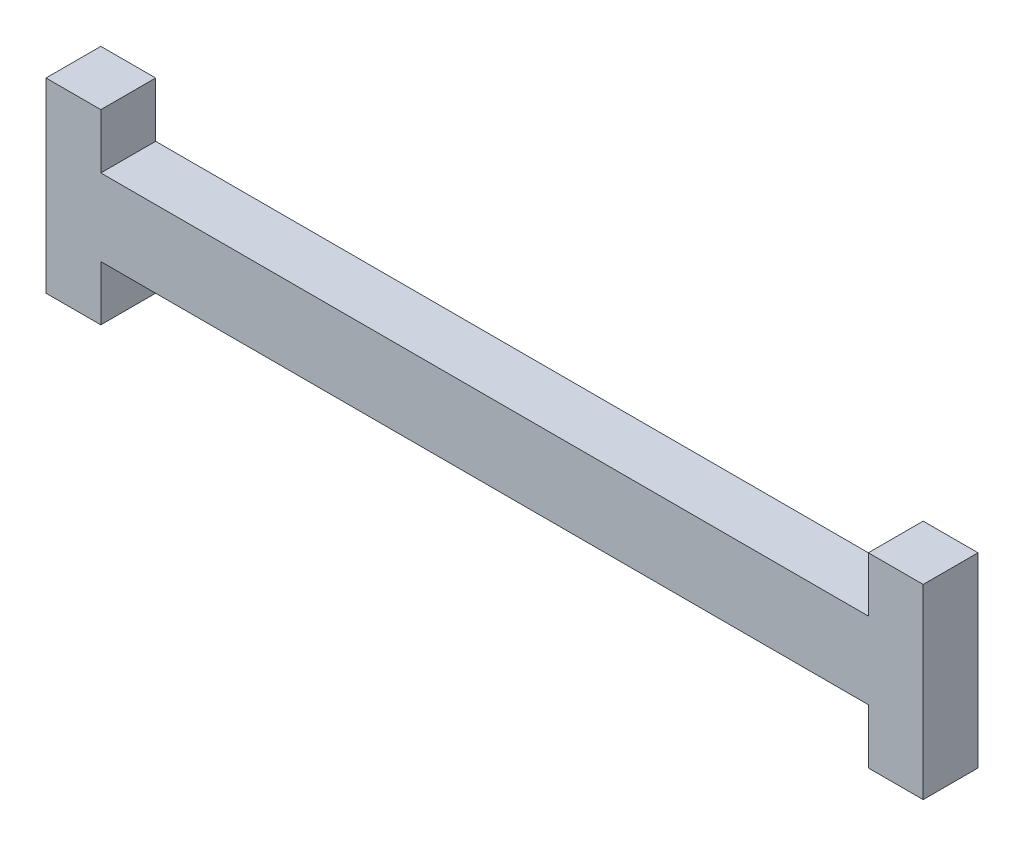
from build123d import *

# Parameters (mm, degrees)
BOSS_EXTRU_1_DEPTH = 5


with BuildPart() as part:
    # Esquisse1 → Boss.-Extru.1 (new body)
    with BuildSketch(Plane.XY):
        Polygon((121.17461402, 222.421111622), (126.17461402, 222.421111622), (126.17461402, 217.421111622), (196.17461402, 217.421111622), (196.17461402, 222.421111622), (201.17461402, 222.421111622), (201.17461402, 205.421111622), (196.17461402, 205.421111622), (196.17461402, 210.421111622), (126.17461402, 210.421111622), (126.17461402, 205.421111622), (121.17461402, 205.421111622), align=None)
    extrude(amount=-BOSS_EXTRU_1_DEPTH)


solid = part.part
